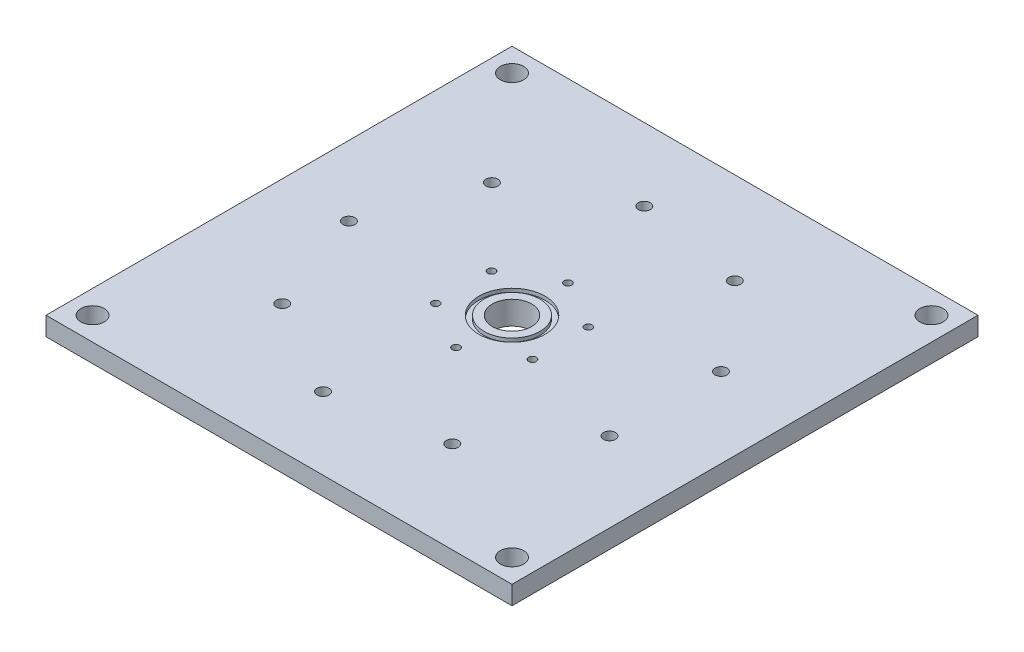
from build123d import *

# Parameters (mm, degrees)
SKETCH1_W           = 127
SKETCH1_H           = 127
BOSS_EXTRUDE1_DEPTH = 5.08
CUT_EXTRUDE1_REACH  = 91.946
SKETCH2_R           = 5.3467
SKETCH4_R           = 9.017
SKETCH4_R_2         = 7.62
CUT_EXTRUDE3_DEPTH  = 0.9779
SKETCH5_R           = 1.03251
CUT_EXTRUDE4_DEPTH  = 3.175
CIRPATTERN1_COUNT   = 6
CUT_EXTRUDE5_REACH  = 91.946
SKETCH6_R           = 1.63195
CIRPATTERN2_COUNT   = 9
CUT_EXTRUDE6_REACH  = 91.946
SKETCH7_R           = 3.175
SKETCH9_R           = 10.9855
SKETCH9_R_2         = 5.3467
BOSS_EXTRUDE2_DEPTH = 1.27


with BuildPart() as part:
    # Sketch1 → Boss-Extrude1 (new body)
    with BuildSketch(Plane(origin=(0, 0, 0), x_dir=(1, 0, 0), z_dir=(0, 1, 0))):
        Rectangle(SKETCH1_W, SKETCH1_H)
    extrude(amount=BOSS_EXTRUDE1_DEPTH)

    # Sketch2 → Cut-Extrude1 (cut, up to next)
    with BuildSketch(Plane(origin=(0, 5.08, 0), x_dir=(1, 0, 0), z_dir=(0, 1, 0)), mode=Mode.PRIVATE) as cut_extrude1_sk1:
        with Locations(Location((0, 0, 0), (0, 0, 270))):
            Circle(SKETCH2_R)
    cut_extrude1_tool1 = extrude(cut_extrude1_sk1.sketch, amount=-CUT_EXTRUDE1_REACH, mode=Mode.PRIVATE) & part.part
    add(cut_extrude1_tool1.solids().sort_by_distance((0, 5.08, 0))[0], mode=Mode.SUBTRACT)

    # Sketch4 → Cut-Extrude3 (cut)
    with BuildSketch(Plane(origin=(0, 5.08, 0), x_dir=(1, 0, 0), z_dir=(0, 1, 0))):
        with Locations(Location((0, 0, 0), (0, 0, 270))):
            Circle(SKETCH4_R)
        with Locations(Location((0, 0, 0), (0, 0, 270))):
            Circle(SKETCH4_R_2, mode=Mode.SUBTRACT)
    extrude(amount=-CUT_EXTRUDE3_DEPTH, mode=Mode.SUBTRACT)

    # Sketch5 → Cut-Extrude4 (cut)
    with BuildSketch(Plane(origin=(0, 5.08, 0), x_dir=(1, 0, 0), z_dir=(0, 1, 0))):
        with Locations(Location((0, -15.24, 0), (0, 0, 270))):
            Circle(SKETCH5_R)
    cut_extrude4 = extrude(amount=-CUT_EXTRUDE4_DEPTH, mode=Mode.SUBTRACT)

    # CirPattern1: Cut-Extrude4 ×6 about axis
    cirpattern1_axis = Axis((0, 0, 0), (0, 1, 0))
    for i in range(1, CIRPATTERN1_COUNT):
        add(cut_extrude4.rotate(cirpattern1_axis, i * 360 / CIRPATTERN1_COUNT), mode=Mode.SUBTRACT)

    # Sketch6 → Cut-Extrude5 (cut, up to next)
    with BuildSketch(Plane(origin=(0, 5.08, 0), x_dir=(1, 0, 0), z_dir=(0, 1, 0)), mode=Mode.PRIVATE) as cut_extrude5_sk1:
        with Locations(Location((22.225, -38.494829198, 0), (0, 0, 270))):
            Circle(SKETCH6_R)
    cut_extrude5_tool1 = extrude(cut_extrude5_sk1.sketch, amount=-CUT_EXTRUDE5_REACH, mode=Mode.PRIVATE) & part.part
    cut_extrude5 = cut_extrude5_tool1.solids().sort_by_distance((22.225, 5.08, 38.494829))[0]
    add(cut_extrude5, mode=Mode.SUBTRACT)

    # CirPattern2: Cut-Extrude5 ×9 about axis
    cirpattern2_axis = Axis((0, 0, 0), (0, 1, 0))
    for i in range(1, CIRPATTERN2_COUNT):
        add(cut_extrude5.rotate(cirpattern2_axis, i * 360 / CIRPATTERN2_COUNT), mode=Mode.SUBTRACT)

    # Sketch7 → Cut-Extrude6 (cut, up to next)
    with BuildSketch(Plane(origin=(0, 5.08, 0), x_dir=(1, 0, 0), z_dir=(0, 1, 0)), mode=Mode.PRIVATE) as cut_extrude6_sk1:
        with Locations(Location((57.15, 57.15, 0), (0, 0, 270))):
            Circle(SKETCH7_R)
    cut_extrude6_tool1 = extrude(cut_extrude6_sk1.sketch, amount=-CUT_EXTRUDE6_REACH, mode=Mode.PRIVATE) & part.part
    # Sketch7 → Cut-Extrude6 (cut, up to next)
    with BuildSketch(Plane(origin=(0, 5.08, 0), x_dir=(1, 0, 0), z_dir=(0, 1, 0)), mode=Mode.PRIVATE) as cut_extrude6_sk2:
        with Locations(Location((57.15, -57.15, 0), (0, 0, 90))):
            Circle(SKETCH7_R)
    cut_extrude6_tool2 = extrude(cut_extrude6_sk2.sketch, amount=-CUT_EXTRUDE6_REACH, mode=Mode.PRIVATE) & part.part
    # Sketch7 → Cut-Extrude6 (cut, up to next)
    with BuildSketch(Plane(origin=(0, 5.08, 0), x_dir=(1, 0, 0), z_dir=(0, 1, 0)), mode=Mode.PRIVATE) as cut_extrude6_sk3:
        with Locations(Location((-57.15, -57.15, 0), (0, 0, 270))):
            Circle(SKETCH7_R)
    cut_extrude6_tool3 = extrude(cut_extrude6_sk3.sketch, amount=-CUT_EXTRUDE6_REACH, mode=Mode.PRIVATE) & part.part
    # Sketch7 → Cut-Extrude6 (cut, up to next)
    with BuildSketch(Plane(origin=(0, 5.08, 0), x_dir=(1, 0, 0), z_dir=(0, 1, 0)), mode=Mode.PRIVATE) as cut_extrude6_sk4:
        with Locations(Location((-57.15, 57.15, 0), (0, 0, 90))):
            Circle(SKETCH7_R)
    cut_extrude6_tool4 = extrude(cut_extrude6_sk4.sketch, amount=-CUT_EXTRUDE6_REACH, mode=Mode.PRIVATE) & part.part
    add(cut_extrude6_tool1.solids().sort_by_distance((57.15, 5.08, -57.15))[0], mode=Mode.SUBTRACT)
    add(cut_extrude6_tool2.solids().sort_by_distance((57.15, 5.08, 57.15))[0], mode=Mode.SUBTRACT)
    add(cut_extrude6_tool3.solids().sort_by_distance((-57.15, 5.08, 57.15))[0], mode=Mode.SUBTRACT)
    add(cut_extrude6_tool4.solids().sort_by_distance((-57.15, 5.08, -57.15))[0], mode=Mode.SUBTRACT)

    # Sketch9 → Boss-Extrude2 (add)
    with BuildSketch(Plane.XZ):
        with Locations(Location((0, 0, 0), (0, 0, 270))):
            Circle(SKETCH9_R)
        with Locations(Location((0, 0, 0), (0, 0, 90))):
            Circle(SKETCH9_R_2, mode=Mode.SUBTRACT)
    extrude(amount=BOSS_EXTRUDE2_DEPTH)


solid = part.part
